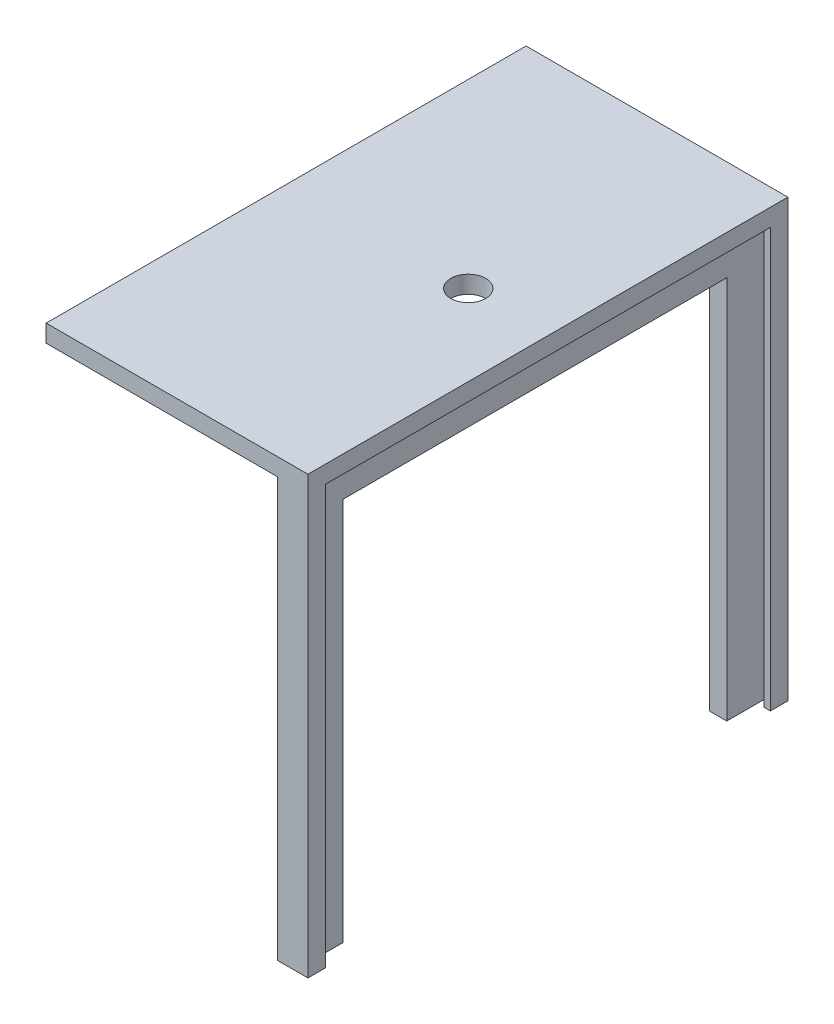
from build123d import *

# Parameters (mm, degrees)
SKETCH1_W           = 57
SKETCH1_H           = 110
BOSS_EXTRUDE1_DEPTH = 4
SKETCH2_W           = 4
SKETCH2_H           = 110
BOSS_EXTRUDE2_DEPTH = 96
SKETCH3_R           = 3.41
BOSS_EXTRUDE3_DEPTH = 4
CUT_EXTRUDE1_REACH  = 121.785
SKETCH4_R           = 4
CUT_EXTRUDE2_REACH  = 126.459
SKETCH5_W           = 88
SKETCH5_H           = 88
BOSS_EXTRUDE4_DEPTH = 55
BOSS_EXTRUDE5_DEPTH = 100


with BuildPart() as part:
    # Sketch1 → Boss-Extrude1 (new body)
    with BuildSketch(Plane(origin=(0, 0, 0), x_dir=(1, 0, 0), z_dir=(0, 1, 0))):
        with Locations((-7.88, 0)):
            Rectangle(SKETCH1_W, SKETCH1_H)
    extrude(amount=BOSS_EXTRUDE1_DEPTH)

    # Sketch2 → Boss-Extrude2 (add)
    with BuildSketch(Plane.XZ):
        with Locations((18.62, 0)):
            Rectangle(SKETCH2_W, SKETCH2_H)
    extrude(amount=BOSS_EXTRUDE2_DEPTH)

    # Sketch3 → Boss-Extrude3 (add)
    # profile 1 of 2: a face of its own
    with BuildSketch(Plane(origin=(-32.38, 0, 0), x_dir=(0, 0, -1), z_dir=(1, 0, 0))):
        with BuildLine():
            Line((45, 0), (45, -5))
            ThreePointArc((45, -5), (40, -10), (35, -5))
            Line((35, -5), (35, 0))
            Line((35, 0), (45, 0))
        make_face()
        with Locations((40, -5)):
            Circle(SKETCH3_R, mode=Mode.SUBTRACT)
    # profile 2 of 2: a face of its own
    with BuildSketch(Plane(origin=(-32.38, 0, 0), x_dir=(0, 0, -1), z_dir=(1, 0, 0))):
        with BuildLine():
            Line((-35, 0), (-35, -5))
            ThreePointArc((-35, -5), (-40, -10), (-45, -5))
            Line((-45, -5), (-45, 0))
            Line((-45, 0), (-35, 0))
        make_face()
        with Locations(Location((-40, -5, 0), (0, 0, 180))):
            Circle(SKETCH3_R, mode=Mode.SUBTRACT)
    extrude(amount=BOSS_EXTRUDE3_DEPTH)

    # Sketch4 → Cut-Extrude1 (cut, up to next)
    with BuildSketch(Plane(origin=(0, 4, 0), x_dir=(1, 0, 0), z_dir=(0, 1, 0)), mode=Mode.PRIVATE) as cut_extrude1_sk1:
        with Locations(Location((5.12, 0.25, 0), (0, 0, 270))):
            Circle(SKETCH4_R)
    cut_extrude1_tool1 = extrude(cut_extrude1_sk1.sketch, amount=-CUT_EXTRUDE1_REACH, mode=Mode.PRIVATE) & part.part
    add(cut_extrude1_tool1.solids().sort_by_distance((5.12, 4, -0.25))[0], mode=Mode.SUBTRACT)

    # Sketch5 → Cut-Extrude2 (cut, up to next)
    with BuildSketch(Plane(origin=(20.62, 0, 0), x_dir=(0, 0, -1), z_dir=(1, 0, 0)), mode=Mode.PRIVATE) as cut_extrude2_sk1:
        with Locations((0, -52)):
            Rectangle(SKETCH5_W, SKETCH5_H)
    cut_extrude2_tool1 = extrude(cut_extrude2_sk1.sketch, amount=-CUT_EXTRUDE2_REACH, mode=Mode.PRIVATE) & part.part
    add(cut_extrude2_tool1.solids().sort_by_distance((20.62, -52, 0))[0], mode=Mode.SUBTRACT)

    # Sketch6 → Boss-Extrude4 (add, symmetric)
    with BuildSketch(Plane.XY):
        Polygon((20.62, 2), (20.62, 4), (23.62, 4), (23.62, 0), (22.12, 0), (22.12, 2), align=None)
    extrude(amount=BOSS_EXTRUDE4_DEPTH, both=True)

    # Sketch7 → Boss-Extrude5 (add)
    with BuildSketch(Plane(origin=(0, 4, 0), x_dir=(1, 0, 0), z_dir=(0, 1, 0))):
        Polygon((23.62, 55), (20.62, 55), (20.62, 53), (22.12, 53), (22.12, 51), (23.62, 51), align=None)
        Polygon((23.62, -51), (23.62, -55), (20.62, -55), (20.62, -53), (22.12, -53), (22.12, -51), align=None)
    extrude(amount=-BOSS_EXTRUDE5_DEPTH)


solid = part.part
